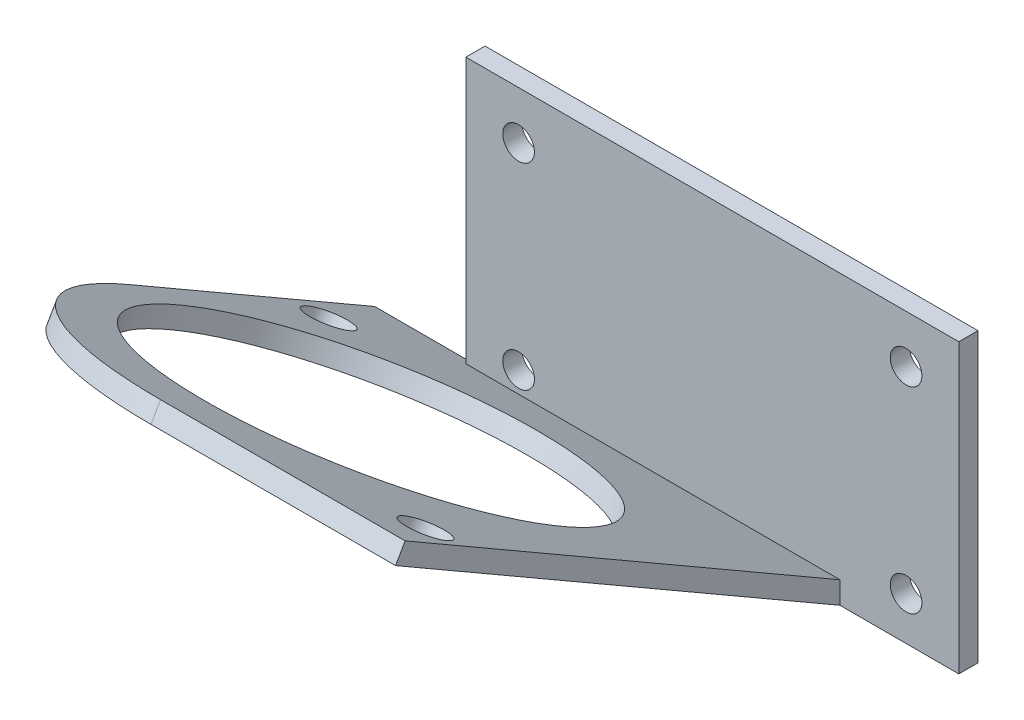
from build123d import *

# Parameters (mm, degrees)
SKETCH1_W           = 51.4
SKETCH1_H           = 30
BOSS_EXTRUDE1_DEPTH = 2
SKETCH2_R           = 1.65
CUT_EXTRUDE1_DEPTH  = 10
SKETCH3_W           = 49.5
SKETCH3_H           = 53.5
BOSS_EXTRUDE2_DEPTH = 2
FILLET1_R           = 24
SKETCH5_R           = 2.25
CUT_EXTRUDE2_DEPTH  = 2
SKETCH6_R           = 20
CUT_EXTRUDE3_DEPTH  = 2


with BuildPart() as part:
    # Sketch1 → Boss-Extrude1 (new body)
    with BuildSketch(Plane.XY):
        with Locations((25.7, 15)):
            Rectangle(SKETCH1_W, SKETCH1_H)
    extrude(amount=BOSS_EXTRUDE1_DEPTH)

    # Sketch2 → Cut-Extrude1 (cut)
    with BuildSketch(Plane(origin=(0, 0, 0), x_dir=(-1, 0, 0), z_dir=(0, 0, -1))):
        with Locations((-45.9, 25)):
            Circle(SKETCH2_R)
        with Locations((-5.5, 25)):
            Circle(SKETCH2_R)
        with Locations((-5.5, 4.5)):
            Circle(SKETCH2_R)
        with Locations((-45.9, 4.5)):
            Circle(SKETCH2_R)
    extrude(amount=-CUT_EXTRUDE1_DEPTH, mode=Mode.SUBTRACT)

    # Sketch3 → Boss-Extrude2 (add)
    with BuildSketch(Plane(origin=(0, -0.8660254037844364, 0.4999999999999961), x_dir=(1, 0, 0), z_dir=(0, -0.8660254037844398, 0.499999999999998))):
        with Locations((14.25, 28.482050808)):
            Rectangle(SKETCH3_W, SKETCH3_H)
    extrude(amount=-BOSS_EXTRUDE2_DEPTH)

    # Fillet1
    fillet1_edges = [part.edges().sort_by_distance(p)[0] for p in [
        (-10.5, 27.616025404, 47.832359102),
    ]]
    fillet(fillet1_edges, radius=FILLET1_R)

    # Sketch5 → Cut-Extrude2 (cut)
    with BuildSketch(Plane(origin=(0, -0.8660254037844378, 0.4999999999999969), x_dir=(1, 0, 0), z_dir=(0, -0.8660254037844399, 0.49999999999999806))):
        with Locations(Location((35.9, 49.210750739, 0), (0, 0, 270))):
            Circle(SKETCH5_R)
        with Locations(Location((-7.1, 11.210750739, 0), (0, 0, 270))):
            Circle(SKETCH5_R)
    extrude(amount=-CUT_EXTRUDE2_DEPTH, mode=Mode.SUBTRACT)

    # Sketch6 → Cut-Extrude3 (cut)
    with BuildSketch(Plane(origin=(0, -0.8660254037844378, 0.4999999999999969), x_dir=(1, 0, 0), z_dir=(0, -0.8660254037844399, 0.49999999999999806))):
        with Locations(Location((12.9, 29.210750739, 0), (0, 0, 270))):
            Circle(SKETCH6_R)
    extrude(amount=-CUT_EXTRUDE3_DEPTH, mode=Mode.SUBTRACT)


solid = part.part
